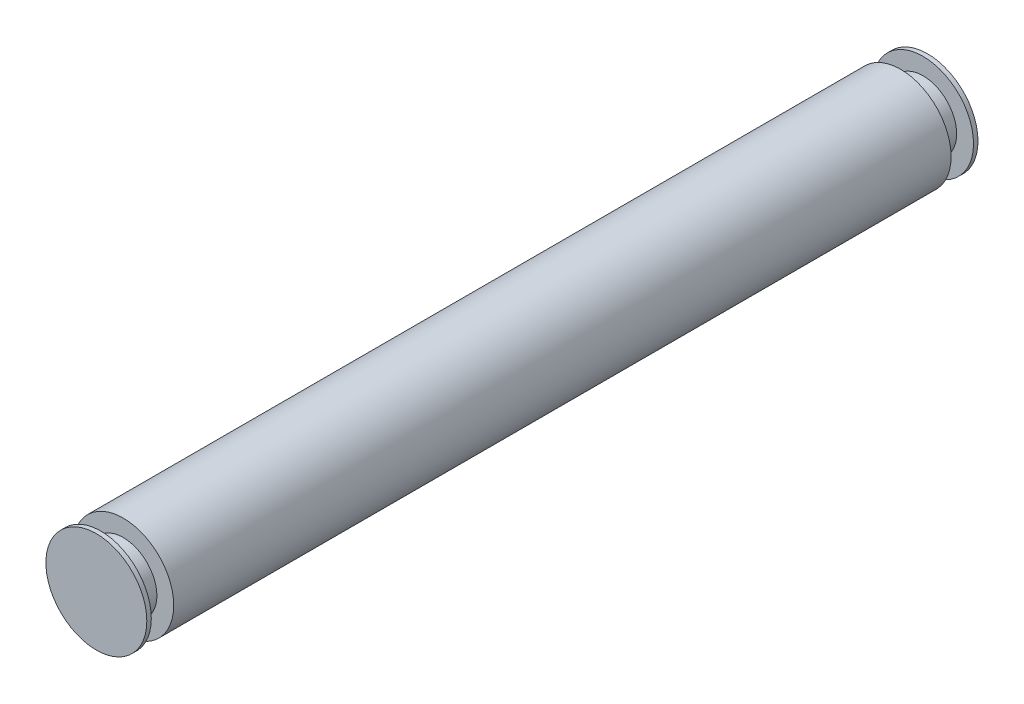
from build123d import *

# Parameters (mm, degrees)
SKETCH1_R           = 22.5
BOSS_EXTRUDE1_DEPTH = 173.335
SKETCH2_R           = 15
BOSS_EXTRUDE2_DEPTH = 10
BOSS_EXTRUDE3_START = 2
SKETCH3_R           = 22.5
BOSS_EXTRUDE3_DEPTH = 2


with BuildPart() as part:
    # Sketch1 → Boss-Extrude1 (new, symmetric)
    with BuildSketch(Plane.XY):
        Circle(SKETCH1_R)
    extrude(amount=BOSS_EXTRUDE1_DEPTH, both=True)

    # Sketch2 → Boss-Extrude2 (add)
    with BuildSketch(Plane.XY.offset(173.335)):
        Circle(SKETCH2_R)
    boss_extrude2 = extrude(amount=BOSS_EXTRUDE2_DEPTH)

    # Sketch3 → Boss-Extrude3 (add)
    with BuildSketch(Plane.XY.offset(183.335).offset(BOSS_EXTRUDE3_START)):
        Circle(SKETCH3_R)
    boss_extrude3 = extrude(amount=-BOSS_EXTRUDE3_DEPTH)

    # Mirror1: Boss-Extrude2, Boss-Extrude3 across plane
    add(boss_extrude2.mirror(Plane.XY))
    add(boss_extrude3.mirror(Plane.XY))


solid = part.part
